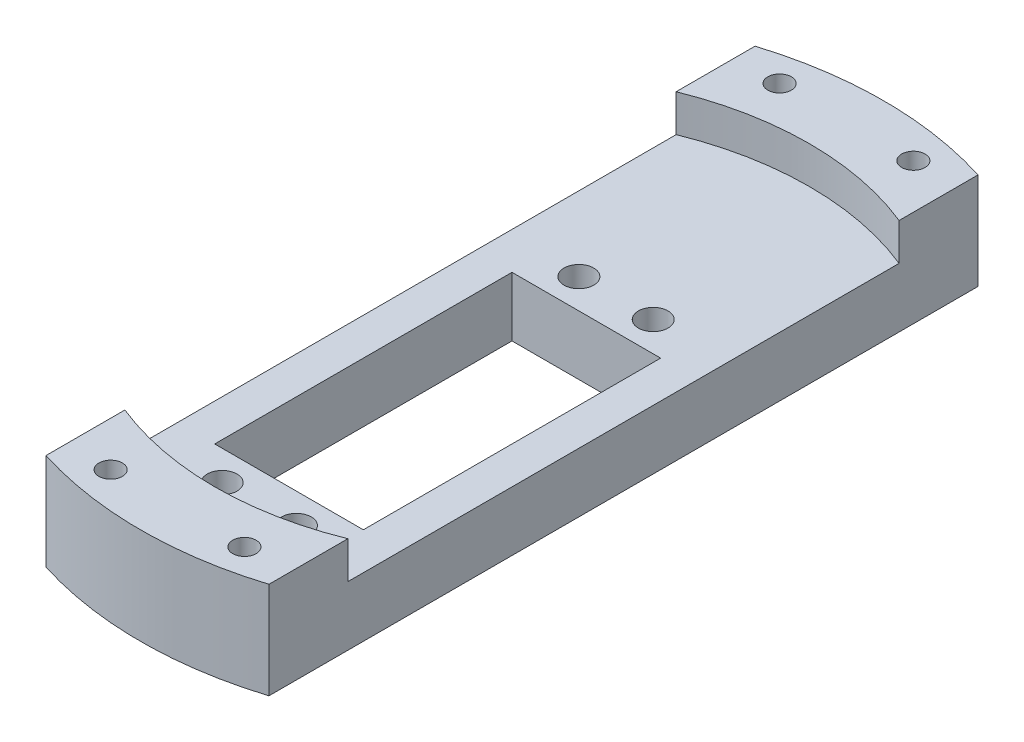
from build123d import *

# Parameters (mm, degrees)
SKETCH_1_R                  = 2
SKETCH_1_W                  = 20
SKETCH_1_H                  = 40
EXTRUDE_1_DEPTH             = 8
EXTRUDE_2_DEPTH             = 5
HOLE_WIZARD_M31_D           = 3.15
PATTERN_LINEAR_1_COUNT      = 2
PATTERN_LINEAR_1_PITCH      = 18
PATTERN_LINEAR_1_COUNT_DIR2 = 2
PATTERN_LINEAR_1_PITCH_DIR2 = 90


with BuildPart() as part:
    # Эскиз1 → Бобышка-Вытянуть1 (new body)
    with BuildSketch(Plane(origin=(0, 0, 0), x_dir=(1, 0, 0), z_dir=(0, 1, 0))):
        with BuildLine():
            Line((-15, -47.696960071), (-15, 47.696960071))
            ThreePointArc((-15, 47.696960071), (0, 50), (15, 47.696960071))
            Line((15, 47.696960071), (15, -47.696960071))
            ThreePointArc((15, -47.696960071), (0, -50), (-15, -47.696960071))
        make_face()
        with Locations(Location((-5, -34, 0), (0, 0, 270))):
            Circle(SKETCH_1_R, mode=Mode.SUBTRACT)
        with Locations(Location((5, -34, 0), (0, 0, 90))):
            Circle(SKETCH_1_R, mode=Mode.SUBTRACT)
        with Locations(Location((5, 14, 0), (0, 0, 270))):
            Circle(SKETCH_1_R, mode=Mode.SUBTRACT)
        with Locations(Location((-5, 14, 0), (0, 0, 90))):
            Circle(SKETCH_1_R, mode=Mode.SUBTRACT)
        with Locations((0, -10)):
            Rectangle(SKETCH_1_W, SKETCH_1_H, mode=Mode.SUBTRACT)
    extrude(amount=EXTRUDE_1_DEPTH)

    # Эскиз2 → Бобышка-Вытянуть2 (add)
    with BuildSketch(Plane(origin=(0, 8, 0), x_dir=(1, 0, 0), z_dir=(0, 1, 0))):
        with BuildLine():
            Line((-15, 37.080992435), (-15, 47.696960071))
            ThreePointArc((-15, 47.696960071), (0, 50), (15, 47.696960071))
            Line((15, 47.696960071), (15, 37.080992435))
            ThreePointArc((15, 37.080992435), (0, 40), (-15, 37.080992435))
        make_face()
        with BuildLine():
            Line((-15, -37.080992435), (-15, -47.696960071))
            ThreePointArc((-15, -47.696960071), (0, -50), (15, -47.696960071))
            Line((15, -47.696960071), (15, -37.080992435))
            ThreePointArc((15, -37.080992435), (0, -40), (-15, -37.080992435))
        make_face()
    extrude(amount=EXTRUDE_2_DEPTH)

    # Сверло под метчик  спиральное M31 (through all)
    with Locations(Plane(origin=(0, 13, 0), x_dir=(1, 0, 0), z_dir=(0, 1, 0))):
        with Locations((-9, -45)):
            hole_wizard_m31 = Hole(HOLE_WIZARD_M31_D / 2)

    # Линейный массив1: Hole Wizard M31 2 × 2
    with Locations(*[(i * PATTERN_LINEAR_1_PITCH, 0, -j * PATTERN_LINEAR_1_PITCH_DIR2) for i in range(PATTERN_LINEAR_1_COUNT) for j in range(PATTERN_LINEAR_1_COUNT_DIR2) if (i, j) != (0, 0)]):
        add(hole_wizard_m31, mode=Mode.SUBTRACT)


solid = part.part
